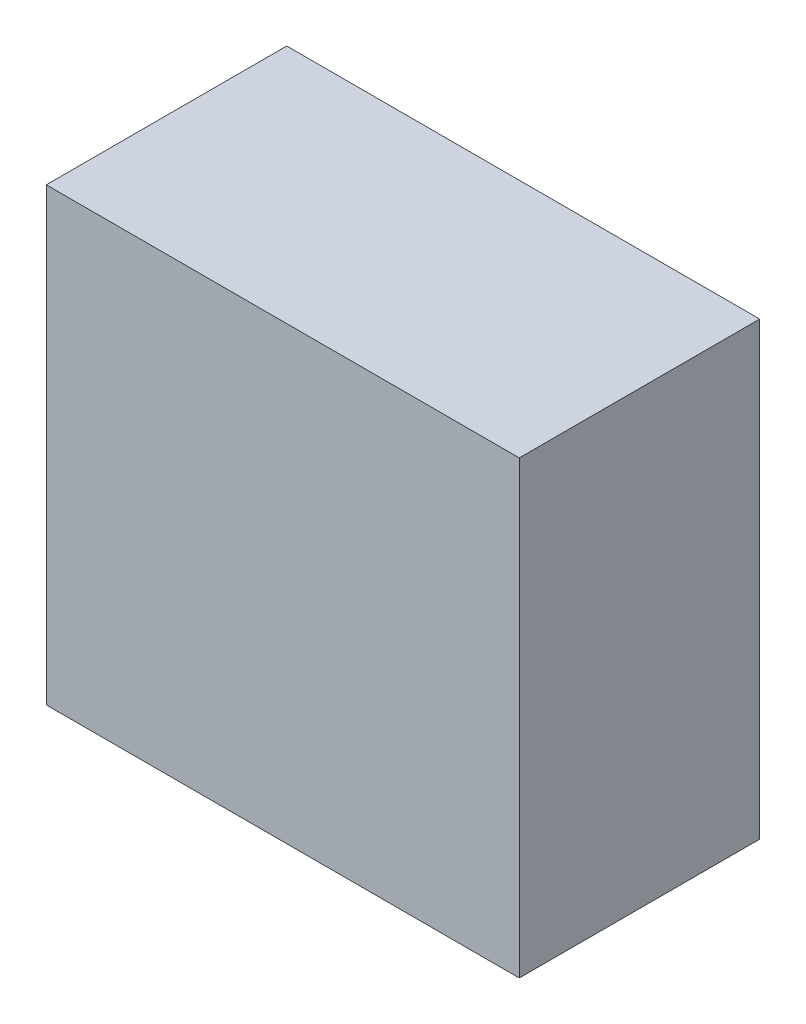
from build123d import *

# Parameters (mm, degrees)
SKETCH_231_W           = 42
SKETCH_231_H           = 21.35
EXTRUDE_279_DEPTH      = 40
SKETCH_331_W           = 16.4
SKETCH_331_H           = 16.4
CUT_EXTRUDE_376_DEPTH  = 5.6
SKETCH_442_R           = 2.75
EXTRUDE_464_DEPTH      = 4.3
MX_DEPTH               = 3.6
SKETCH_628_W           = 3.066
SKETCH_628_H           = 1.736
CUT_EXTRUDE_1061_DEPTH = 0.3


with BuildPart() as part:
    # Sketch 231 → Extrude 279 (new body)
    with BuildSketch(Plane(origin=(0, 15.5, 0), x_dir=(1, 0, 0), z_dir=(0, 1, 0))):
        with Locations((15, -4.325)):
            Rectangle(SKETCH_231_W, SKETCH_231_H)
    extrude(amount=EXTRUDE_279_DEPTH)

    # Sketch 331 → Cut-Extrude 376 (cut)
    with BuildSketch(Plane(origin=(0, 15.5, 0), x_dir=(1, 0, 0), z_dir=(0, 1, 0))):
        with Locations((15, -4.325)):
            Rectangle(SKETCH_331_W, SKETCH_331_H)
    extrude(amount=CUT_EXTRUDE_376_DEPTH, mode=Mode.SUBTRACT)

    # Sketch 442 → Extrude 464 (add)
    with BuildSketch(Plane(origin=(0, 21.1, 0), x_dir=(1, 0, 0), z_dir=(0, 1, 0))):
        with Locations(Location((15, -4.325, 0), (0, 0, 270))):
            Circle(SKETCH_442_R)
    extrude(amount=-EXTRUDE_464_DEPTH)

    # MX 2 → MX (cut)
    with BuildSketch(Plane(origin=(0, 16.8, 0), x_dir=(1, 0, 0), z_dir=(0, 1, 0))):
        Polygon((14.325, -2.225), (15.675, -2.225), (15.675, -3.65), (17.1, -3.65), (17.1, -5), (15.675, -5), (15.675, -6.425), (14.325, -6.425), (14.325, -5), (12.9, -5), (12.9, -3.65), (14.325, -3.65), align=None)
    extrude(amount=MX_DEPTH, mode=Mode.SUBTRACT)

    # Sketch 628 → Cut-Extrude 1061 (cut)
    # profile 1 of 6: a face of its own
    with BuildSketch(Plane.XY.offset(-6.35)):
        Polygon((29.007, 35.514), (22.147, 35.514), (22.068833333, 36.644888889), (22.002333333, 37.778888889), (21.9475, 38.916), (21.904333333, 40.056222222), (21.872833333, 41.199555556), (21.853, 42.346), (19.753, 42.346), (19.795, 40.732888889), (19.837, 39.309555556), (19.879, 38.076), (19.921, 37.032222222), (19.963, 36.178222222), (20.005, 35.514), (15.371, 35.514), (15.371, 33.694), (20.383, 33.694), (20.413333333, 33.594055556), (20.448333333, 33.490222222), (20.488, 33.3825), (20.532333333, 33.270888889), (20.581333333, 33.155388889), (20.635, 33.036), (19.797722222, 32.650611111), (18.947222222, 32.241111111), (18.0835, 31.8075), (17.206555556, 31.349777778), (16.316388889, 30.867944444), (15.413, 30.362), (16.729, 28.612), (17.521944444, 29.1195), (18.332777778, 29.615333333), (19.1615, 30.0995), (20.008111111, 30.572), (20.872611111, 31.032833333), (21.755, 31.482), (22.454222222, 30.878055556), (23.273222222, 30.316888889), (24.212, 29.7985), (25.270555556, 29.322888889), (26.448888889, 28.890055556), (27.747, 28.5), (27.974111111, 28.834833333), (28.198111111, 29.158), (28.419, 29.4695), (28.636777778, 29.769333333), (28.851444444, 30.0575), (29.063, 30.334), (27.321555556, 30.785111111), (25.849222222, 31.279777778), (24.646, 31.818), (23.711888889, 32.399777778), (23.046888889, 33.025111111), (22.651, 33.694), (29.007, 33.694), align=None)
    # profile 2 of 6: a face of its own
    with BuildSketch(Plane.XY.offset(-6.35)):
        Polygon((27.467, 39.448), (26.858388889, 39.101888889), (26.245888889, 38.744888889), (25.6295, 38.377), (25.009222222, 37.998222222), (24.385055556, 37.608555556), (23.757, 37.208), (24.947, 35.626), (25.594111111, 36.067), (26.219444444, 36.484666667), (26.823, 36.879), (27.404777778, 37.25), (27.964777778, 37.597666667), (28.503, 37.922), align=None)
    # profile 3 of 6: a face of its own
    with BuildSketch(Plane.XY.offset(-6.35)):
        Polygon((26.109, 42.234), (25.525666667, 41.937277778), (24.933, 41.625777778), (24.331, 41.2995), (23.719666667, 40.958444444), (23.099, 40.602611111), (22.469, 40.232), (23.589, 38.664), (24.223666667, 39.077777778), (24.839666667, 39.469777778), (25.437, 39.84), (26.015666667, 40.188444444), (26.575666667, 40.515111111), (27.117, 40.82), align=None)
    # profile 4 of 6: a face of its own
    with BuildSketch(Plane.XY.offset(-6.35)):
        Polygon((7.223, 39.35), (9.064, 39.35), (7.545, 38.734), (7.698805556, 38.494444444), (7.856888889, 38.251777778), (8.01925, 38.006), (8.185888889, 37.757111111), (8.356805556, 37.505111111), (8.532, 37.25), (6.915, 37.25), (6.915, 35.682), (14.769, 35.682), (14.769, 37.25), (13.096, 37.25), (13.234638889, 37.461555556), (13.379888889, 37.676222222), (13.53175, 37.894), (13.690222222, 38.114888889), (13.855305556, 38.338888889), (14.027, 38.566), (12.662, 39.35), (14.447, 39.35), (14.447, 40.918), (11.731, 40.918), (11.806833333, 41.133055556), (11.885, 41.344222222), (11.9655, 41.5515), (12.048333333, 41.754888889), (12.1335, 41.954388889), (12.221, 42.15), (10.121, 42.5), (10.030972222, 42.257722222), (9.942888889, 42.006888889), (9.85675, 41.7475), (9.772555556, 41.479555556), (9.690305556, 41.203055556), (9.61, 40.918), (7.223, 40.918), align=None)
        Polygon((11.213, 37.782), (12.172, 37.25), (10.625, 37.25), (10.400416667, 37.601944444), (10.188666667, 37.953111111), (9.98975, 38.3035), (9.803666667, 38.653111111), (9.630416667, 39.001944444), (9.47, 39.35), (12.438, 39.35), (12.176472222, 39.045888889), (11.937888889, 38.758888889), (11.72225, 38.489), (11.529555556, 38.236222222), (11.359805556, 38.000555556), align=None, mode=Mode.SUBTRACT)
    # profile 5 of 6: a face of its own
    with BuildSketch(Plane.XY.offset(-6.35)):
        Polygon((2.715, 36.606), (2.171722222, 36.005166667), (1.727222222, 35.388), (1.3815, 34.7545), (1.134555556, 34.104666667), (0.986388889, 33.4385), (0.937, 32.756), (0.954208333, 32.385097222), (1.005833333, 32.042388889), (1.091875, 31.727875), (1.212333333, 31.441555556), (1.367208333, 31.183430556), (1.5565, 30.9535), (1.799652778, 30.756430556), (2.116111111, 30.596888889), (2.505875, 30.474875), (2.968944444, 30.390388889), (3.505319444, 30.343430556), (4.115, 30.334), (4.151944444, 30.666111111), (4.197444444, 30.999777778), (4.2515, 31.335), (4.314111111, 31.671777778), (4.385277778, 32.010111111), (4.465, 32.35), (4.293694444, 32.324333333), (4.139111111, 32.303333333), (4.00125, 32.287), (3.880111111, 32.275333333), (3.775694444, 32.268333333), (3.688, 32.266), (3.424916667, 32.289722222), (3.209666667, 32.360888889), (3.04225, 32.4795), (2.922666667, 32.645555556), (2.850916667, 32.859055556), (2.827, 33.12), (2.873666667, 33.647722222), (3.013666667, 34.185555556), (3.247, 34.7335), (3.573666667, 35.291555556), (3.993666667, 35.859722222), (4.507, 36.438), (4.266666667, 37.019), (4.031, 37.614), (3.8, 38.223), (3.573666667, 38.846), (3.352, 39.483), (3.135, 40.134), (4.661, 40.134), (4.661, 28.626), (6.453, 28.626), (6.453, 41.758), (1.203, 41.758), (1.203, 40.414), (1.381111111, 39.934888889), (1.588777778, 39.393555556), (1.826, 38.79), (2.092777778, 38.124222222), (2.389111111, 37.396222222), align=None)
    # profile 6 of 6: a face of its own
    with BuildSketch(Plane.XY.offset(-6.35)):
        Polygon((14.139, 28.948), (14.139, 34.618), (7.545, 34.618), (7.545, 29.032), (9.309, 29.032), (9.309, 29.746), (12.375, 29.746), (12.375, 28.948), align=None)
        with Locations((10.842, 32.182)):
            Rectangle(SKETCH_628_W, SKETCH_628_H, mode=Mode.SUBTRACT)
    extrude(amount=CUT_EXTRUDE_1061_DEPTH, mode=Mode.SUBTRACT)


solid = part.part
